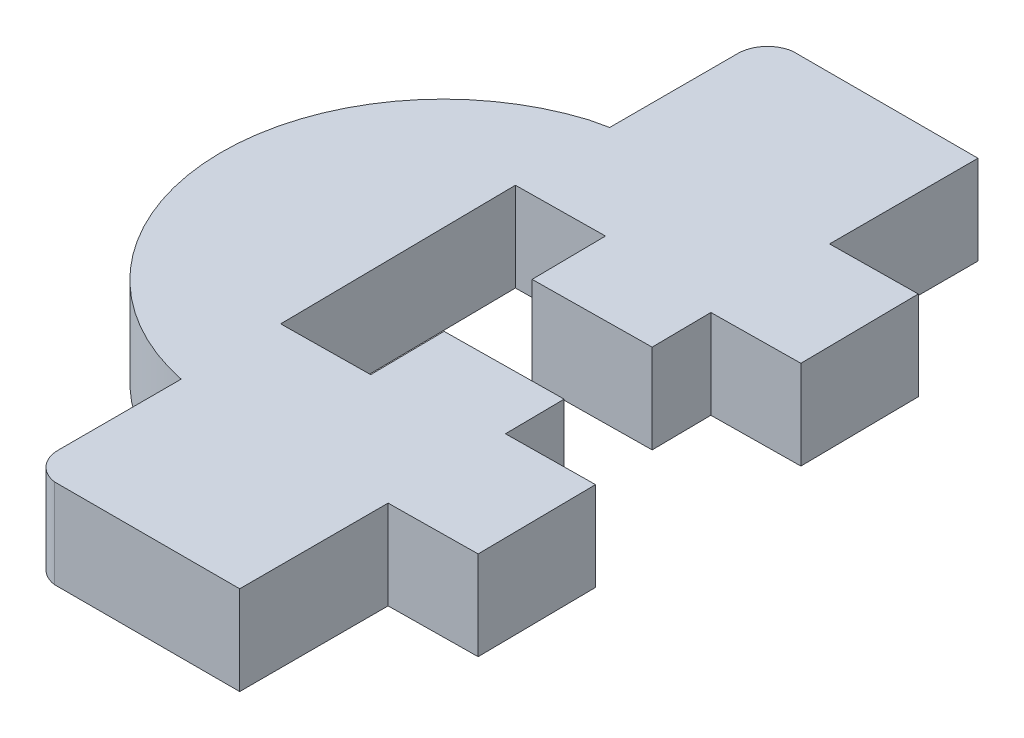
from build123d import *

# Parameters (mm, degrees)
SALIENTE_EXTRUIR1_DEPTH = 3


with BuildPart() as part:
    # Croquis1 → Saliente-Extruir1 (new body)
    with BuildSketch(Plane(origin=(0, 0, 0), x_dir=(1, 0, 0), z_dir=(0, 1, 0))):
        with BuildLine():
            Line((33638.899606001, 12674.802256187), (33638.31321683, 12674.669512098))
            ThreePointArc((33638.31321683, 12674.669512098), (33633.089099042, 12667.180361564), (33639.024595085, 12660.24143736))
            Line((33639.024595085, 12660.24143736), (33639.024595085, 12656.099650441))
            ThreePointArc((33639.024595085, 12656.099650441), (33639.269455485, 12655.444618543), (33639.883952447, 12655.11082686))
            Line((33639.883952447, 12655.11082686), (33646.127320324, 12655.11082686))
            Line((33646.127320324, 12655.11082686), (33646.127126628, 12660.11082686))
            Line((33646.127126628, 12660.11082686), (33649.127126628, 12660.144916986))
            Line((33649.127126628, 12660.144916986), (33649.081676061, 12664.144658758))
            Line((33649.081676061, 12664.144658758), (33646.081869732, 12664.110570833))
            Line((33646.081869732, 12664.110570833), (33646.059144449, 12666.11044172))
            Line((33646.059144449, 12666.11044172), (33642.059402676, 12666.064991153))
            Line((33642.059402676, 12666.064991153), (33642.087809281, 12663.565152545))
            Line((33642.087809281, 12663.565152545), (33639.088002951, 12663.53106462))
            Line((33639.088002951, 12663.53106462), (33639.059596347, 12666.030903228))
            Line((33639.059596347, 12666.030903228), (33639.025508422, 12669.030709557))
            Line((33639.025508422, 12669.030709557), (33638.997101818, 12671.530548165))
            Line((33638.997101818, 12671.530548165), (33641.996908147, 12671.56463609))
            Line((33641.996908147, 12671.56463609), (33642.025314751, 12669.064797482))
            Line((33642.025314751, 12669.064797482), (33646.025056524, 12669.110248049))
            Line((33646.025056524, 12669.110248049), (33646.00233124, 12671.110118935))
            Line((33646.00233124, 12671.110118935), (33649.00213757, 12671.14420686))
            Line((33649.00213757, 12671.14420686), (33648.956687003, 12675.143948633))
            Line((33648.956687003, 12675.143948633), (33646.00233124, 12675.110377179))
            Line((33646.00233124, 12675.110377179), (33646.00233124, 12680.110377179))
            Line((33646.00233124, 12680.110377179), (33639.758963363, 12680.110377179))
            ThreePointArc((33639.758963363, 12680.110377179), (33639.144466402, 12679.776585497), (33638.899606001, 12679.121553599))
            Line((33638.899606001, 12679.121553599), (33638.899606001, 12674.802256187))
        make_face()
    extrude(amount=SALIENTE_EXTRUIR1_DEPTH)


solid = part.part
